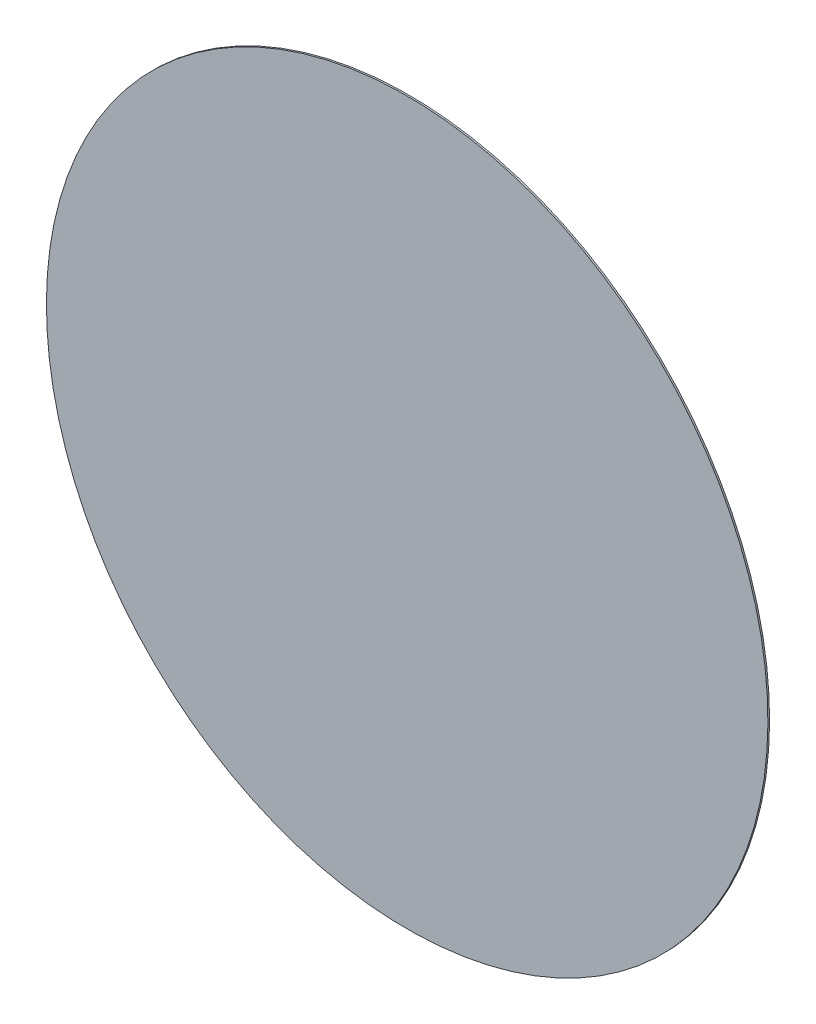
from build123d import *

# Parameters (mm, degrees)
CURVEBOSS_DEPTH = 0.173


with BuildPart() as part:
    # CurveSketch → CurveBoss (new body)
    with BuildSketch(Plane.XY):
        with BuildLine():
            Line((53.698069335, -16.598665607), (53.685586413, -16.534963119))
            ThreePointArc((53.685586413, -16.534963119), (-19.305841771, -30.871188361), (53.698069335, -16.598665607))
        make_face()
    extrude(amount=CURVEBOSS_DEPTH)


solid = part.part
